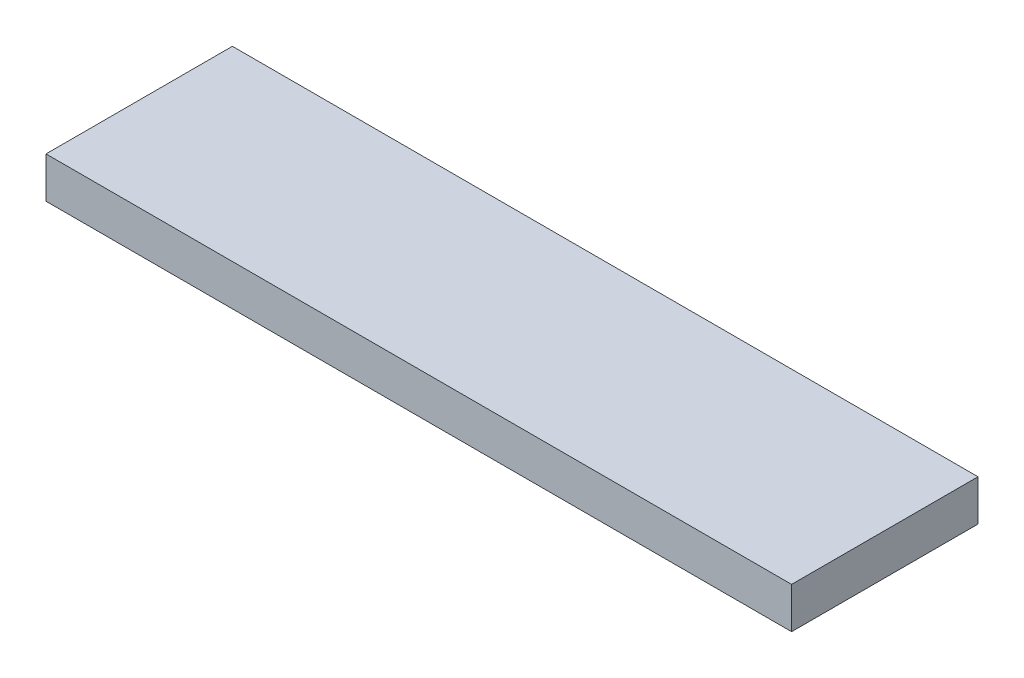
from build123d import *

# Parameters (mm, degrees)
SKETCH_1_W      = 1000
SKETCH_1_H      = 250
EXTRUDE_1_DEPTH = 55


with BuildPart() as part:
    # 草图1 → 凸台-拉伸1 (new body)
    with BuildSketch(Plane(origin=(0, 0, 0), x_dir=(1, 0, 0), z_dir=(0, 1, 0))):
        Rectangle(SKETCH_1_W, SKETCH_1_H)
    extrude(amount=EXTRUDE_1_DEPTH)


solid = part.part
